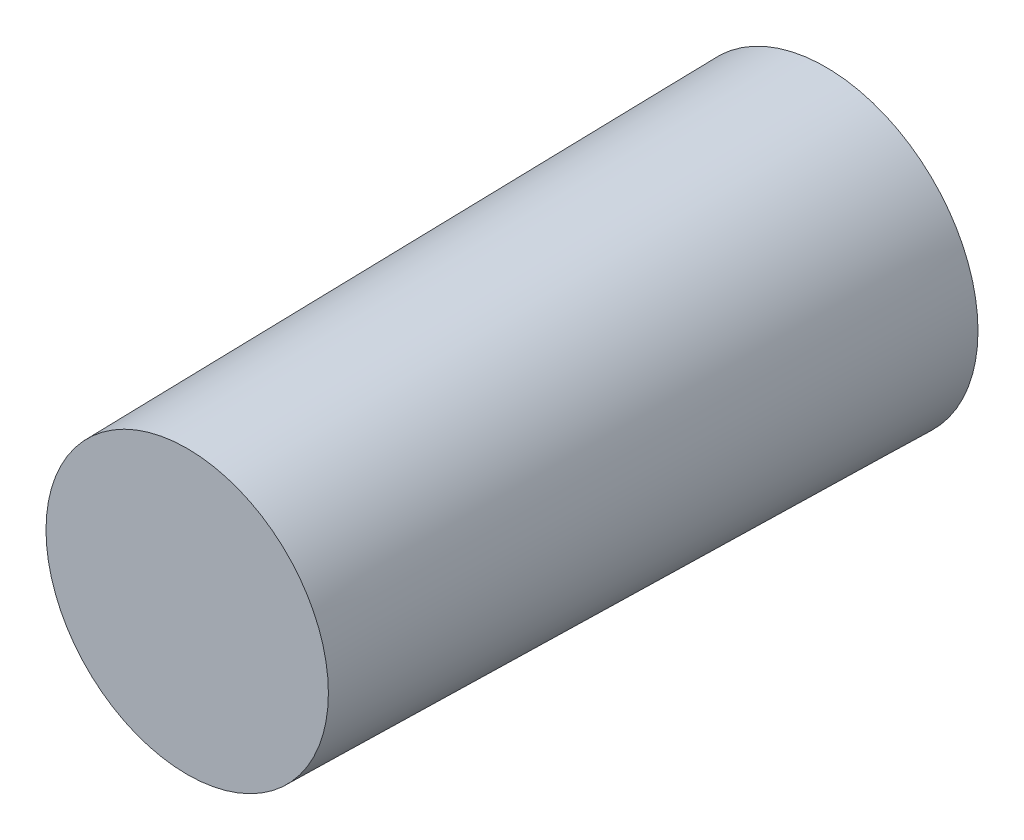
from build123d import *

# Parameters (mm, degrees)
SKETCH1_R           = 2.875
BOSS_EXTRUDE1_DEPTH = 13
DRAFT1_ANGLE        = 1


with BuildPart() as part:
    # Sketch1 → Boss-Extrude1 (new body)
    with BuildSketch(Plane.XY):
        with Locations(Location((0, 0, 0), (0, 0, 180))):
            Circle(SKETCH1_R)
    extrude(amount=BOSS_EXTRUDE1_DEPTH)

    # Draft1
    draft1_faces = [part.faces().sort_by_distance(p)[0] for p in [
        (2.875, 0, 6.5),
    ]]
    draft(draft1_faces, Plane.XY.offset(13), DRAFT1_ANGLE)


solid = part.part
